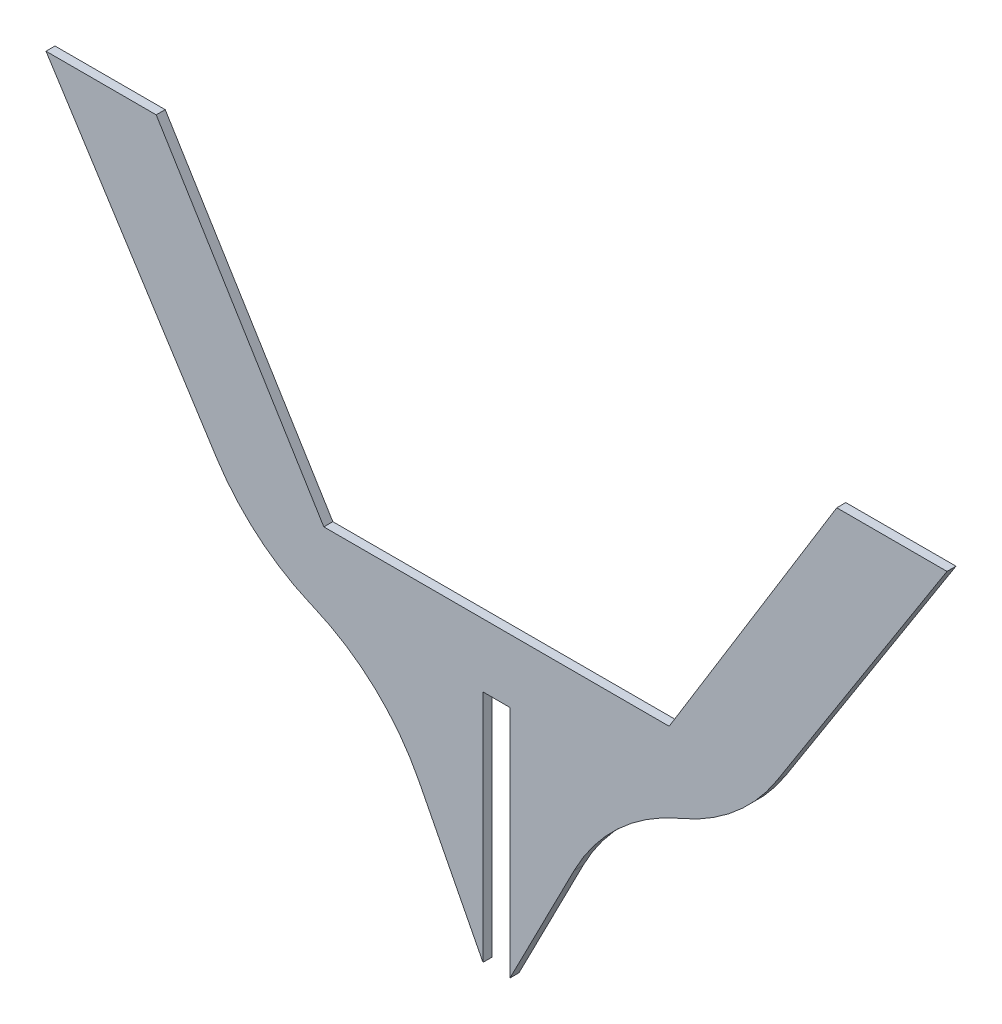
from build123d import *

# Parameters (mm, degrees)
BOSS_EXTRU_3_DEPTH = 3
CONG_2_R           = 70


with BuildPart() as part:
    # Esquisse3 → Boss.-Extru.3 (new body)
    with BuildSketch(Plane.XY):
        Polygon((13.357866614, 115.913304382), (57.664385656, 96.982337155), (90.552829187, 32.788457785), (90.552829187, 110.788457785), (99.552829187, 110.788457785), (99.552829187, 32.788457785), (132.441272718, 96.982337155), (176.74779176, 115.913304382), (245.052829187, 222.788457785), (208.357101389, 222.788457785), (152.545067545, 131.878134616), (37.56059083, 131.878134616), (-18.251443014, 222.788457785), (-54.947170813, 222.788457785), align=None)
    extrude(amount=BOSS_EXTRU_3_DEPTH)

    # Congé2
    cong_2_edges = [part.edges().sort_by_distance(p)[0] for p in [
        (176.74779176, 115.913304382, 1.5),
        (132.441272718, 96.982337155, 1.5),
        (57.664385656, 96.982337155, 1.5),
        (13.357866614, 115.913304382, 1.5),
    ]]
    fillet(cong_2_edges, radius=CONG_2_R)


solid = part.part
